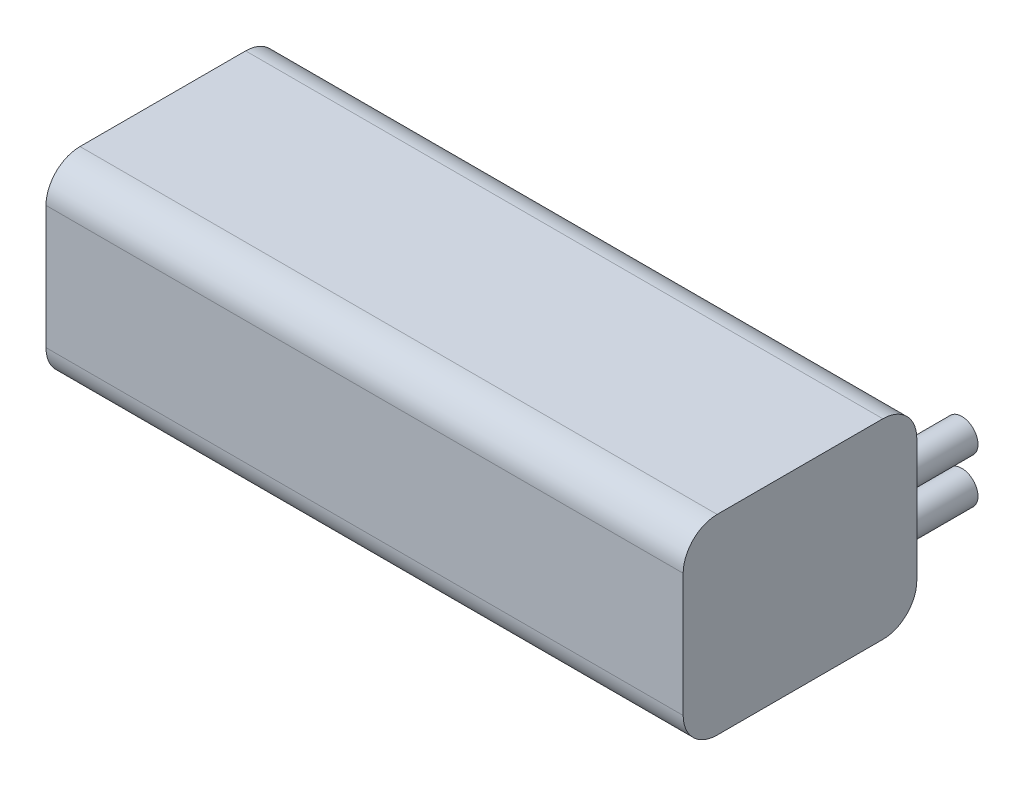
from build123d import *

# Parameters (mm, degrees)
ESBO_O1_W                = 150
ESBO_O1_H                = 55
RESSALTO_EXTRUS_O1_DEPTH = 45
FILETE1_R                = 8
ESBO_O2_R                = 3.81
RESSALTO_EXTRUS_O2_DEPTH = 16.806
ESBO_O4_R                = 3.81
RESSALTO_EXTRUS_O3_DEPTH = 16.806


with BuildPart() as part:
    # Esboço1 → Ressalto-extrusão1 (new body)
    with BuildSketch(Plane(origin=(0, 0, 0), x_dir=(1, 0, 0), z_dir=(0, 1, 0))):
        Rectangle(ESBO_O1_W, ESBO_O1_H)
    extrude(amount=RESSALTO_EXTRUS_O1_DEPTH)

    # Filete1
    filete1_edges = [part.edges().sort_by_distance(p)[0] for p in [
        (0, 45, -27.5),
        (0, 0, -27.5),
        (0, 0, 27.5),
        (0, 45, 27.5),
    ]]
    fillet(filete1_edges, radius=FILETE1_R)

    # Esboço2 → Ressalto-extrusão2 (add)
    with BuildSketch(Plane(origin=(0, 0, -27.5), x_dir=(-1, 0, 0), z_dir=(0, 0, -1))):
        with Locations(Location((-68.791943754, 15.581709397, 0), (0, 0, 180))):
            Circle(ESBO_O2_R)
    extrude(amount=RESSALTO_EXTRUS_O2_DEPTH)

    # Esboço4 → Ressalto-extrusão3 (add)
    with BuildSketch(Plane(origin=(0, 0, -27.5), x_dir=(-1, 0, 0), z_dir=(0, 0, -1))):
        with Locations(Location((-68.791943754, 26.164871882, 0), (0, 0, 180))):
            Circle(ESBO_O4_R)
    extrude(amount=RESSALTO_EXTRUS_O3_DEPTH)


solid = part.part
